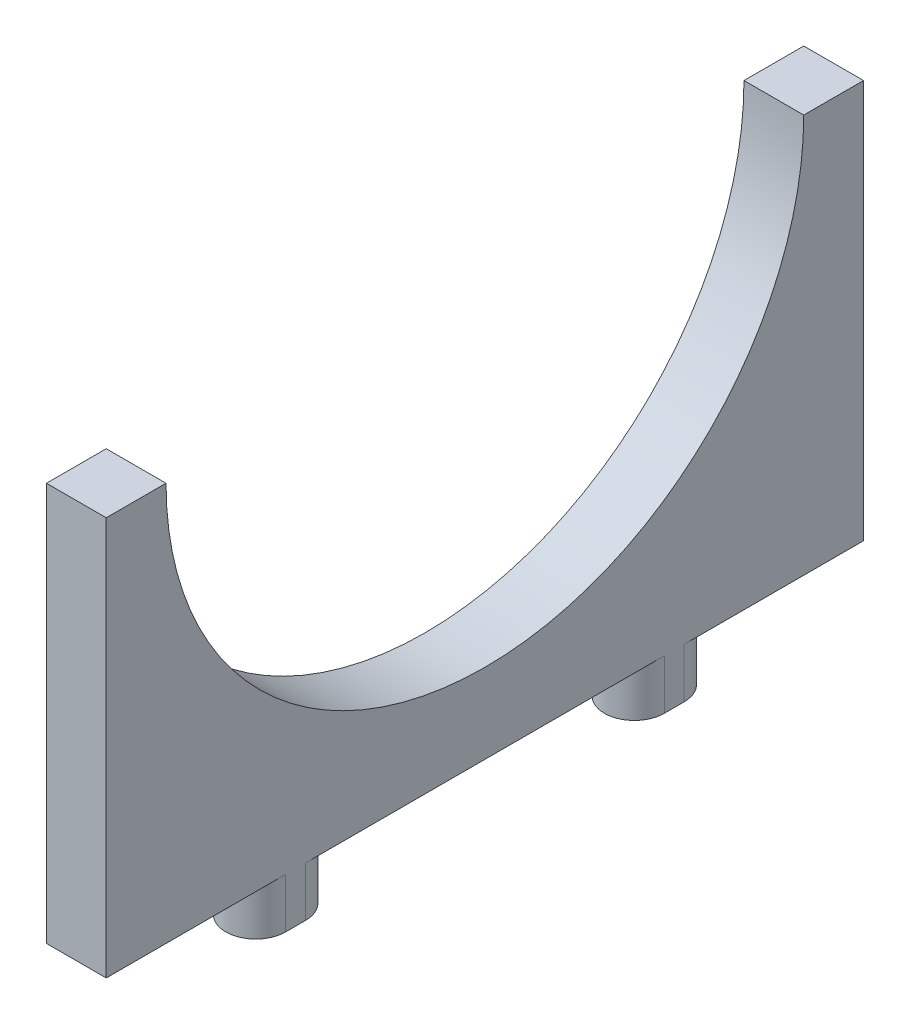
from build123d import *

# Parameters (mm, degrees)
BOSS_EXTRUDE1_DEPTH = 6
BOSS_EXTRUDE2_DEPTH = 5


with BuildPart() as part:
    # Sketch1 → Boss-Extrude1 (new body)
    with BuildSketch(Plane(origin=(0, 0, 0), x_dir=(0, 0, -1), z_dir=(1, 0, 0))):
        with BuildLine():
            Line((-38, 0), (-32, 0))
            ThreePointArc((-32, 0), (0, -32), (32, 0))
            Line((32, 0), (38, 0))
            Line((38, 0), (38, -40))
            Line((38, -40), (-38, -40))
            Line((-38, -40), (-38, 0))
        make_face()
    extrude(amount=BOSS_EXTRUDE1_DEPTH)

    # Sketch3 → Boss-Extrude2 (add)
    with BuildSketch(Plane.XZ.offset(40)):
        with BuildLine():
            Line((0, 20), (0, 18))
            ThreePointArc((0, 18), (3, 15), (6, 18))
            Line((6, 18), (6, 20))
            ThreePointArc((6, 20), (3, 23), (0, 20))
        make_face()
        with BuildLine():
            Line((0, -18), (0, -20))
            ThreePointArc((0, -20), (3, -23), (6, -20))
            Line((6, -20), (6, -18))
            ThreePointArc((6, -18), (3, -15), (0, -18))
        make_face()
    extrude(amount=BOSS_EXTRUDE2_DEPTH)


solid = part.part
